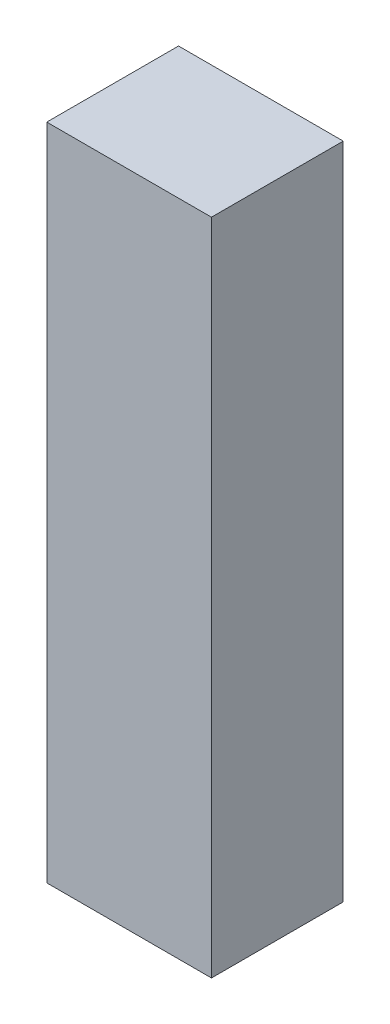
from build123d import *

# Parameters (mm, degrees)
TOPPING_ARKA_DUVAR_PANO_SURUCU_3_1_START = -736
SKETCH1_W                                = 50
SKETCH1_H                                = 200
TOPPING_ARKA_DUVAR_PANO_SURUCU_3_1_DEPTH = 40


with BuildPart() as part:
    # Sketch1 → TOPPING_arka_duvar_pano_surucu_3_1 (new body)
    with BuildSketch(Plane.XY.offset(TOPPING_ARKA_DUVAR_PANO_SURUCU_3_1_START)):
        with Locations((305, 430)):
            Rectangle(SKETCH1_W, SKETCH1_H)
    extrude(amount=-TOPPING_ARKA_DUVAR_PANO_SURUCU_3_1_DEPTH)


solid = part.part
